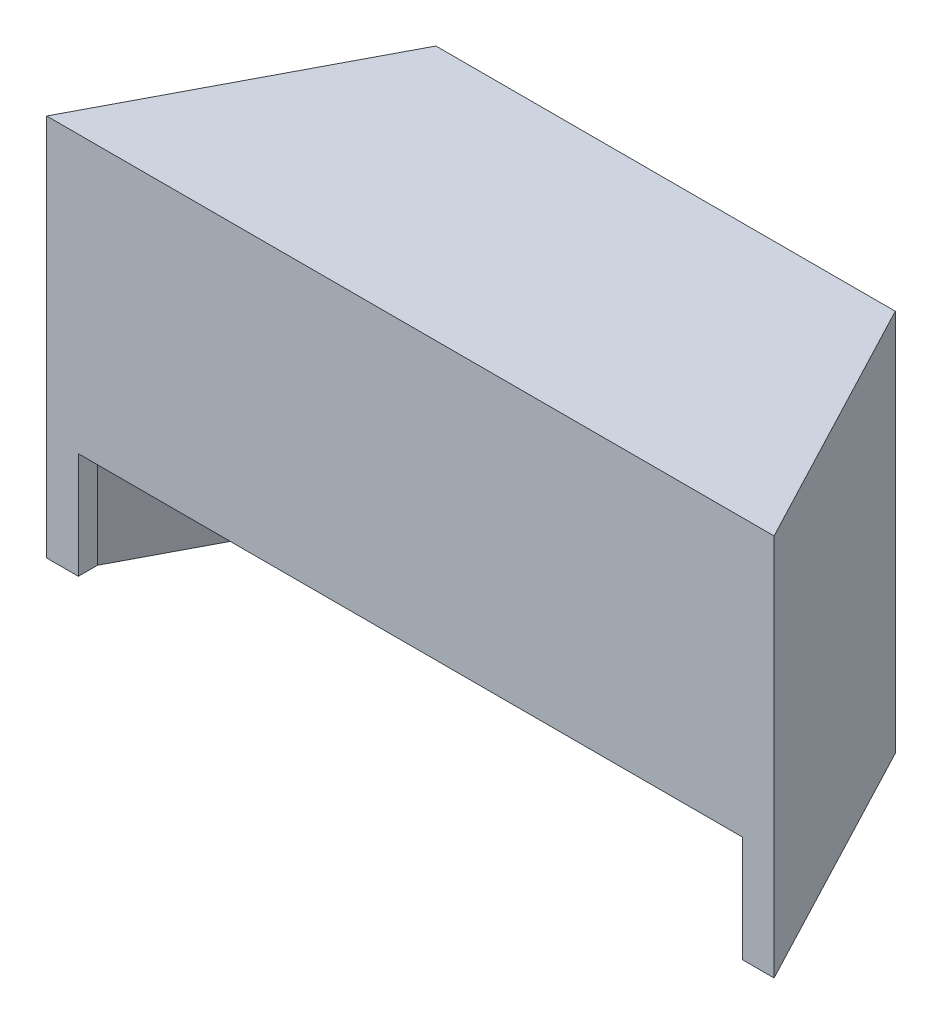
from build123d import *

# Parameters (mm, degrees)
SALIENTE_EXTRUIR1_DEPTH = 30
VACIADO1_T              = -1.5
CROQUIS4_W              = 36
CROQUIS4_H              = 8.3
CORTAR_EXTRUIR2_DEPTH   = 10
CROQUIS5_W              = 52.0366929
CROQUIS5_H              = 8.322917461
CORTAR_EXTRUIR3_DEPTH   = 10


with BuildPart() as part:
    # Croquis1 → Saliente-Extruir1 (new body)
    with BuildSketch(Plane(origin=(0, 0, 0), x_dir=(1, 0, 0), z_dir=(0, 1, 0))):
        Polygon((-28.5, -0.205897881), (-18, 19.794102119), (18, 19.794102119), (28.5, -0.205897881), align=None)
    extrude(amount=SALIENTE_EXTRUIR1_DEPTH)

    # Vaciado1
    vaciado1_openings = [part.faces().sort_by_distance(p)[0] for p in [
        (0, 0, -9.041413947),
    ]]
    offset(amount=VACIADO1_T, openings=vaciado1_openings, kind=Kind.INTERSECTION)

    # Croquis4 → Cortar-Extruir2 (cut)
    with BuildSketch(Plane(origin=(0, 0, -19.794102119), x_dir=(-1, 0, 0), z_dir=(0, 0, -1))):
        with Locations((0, 4.15)):
            Rectangle(CROQUIS4_W, CROQUIS4_H)
    extrude(amount=-CORTAR_EXTRUIR2_DEPTH, mode=Mode.SUBTRACT)

    # Croquis5 → Cortar-Extruir3 (cut)
    with BuildSketch(Plane(origin=(0, 0, -1.294102119), x_dir=(-1, 0, 0), z_dir=(0, 0, -1))):
        with Locations((0, 4.161458731)):
            Rectangle(CROQUIS5_W, CROQUIS5_H)
    extrude(amount=-CORTAR_EXTRUIR3_DEPTH, mode=Mode.SUBTRACT)


solid = part.part
